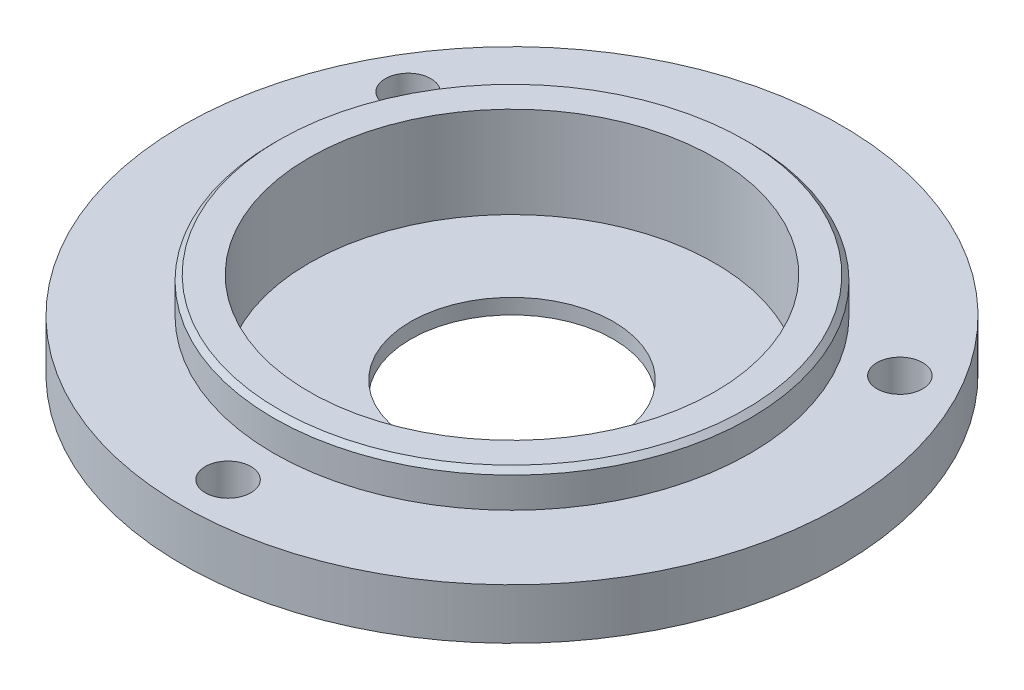
from build123d import *

# Parameters (mm, degrees)
ESQUISSE2_R                  = 2.25
ENL_V_MAT_EXTRU_1_DEPTH      = 47.491934784
R_P_TITION_CIRCULAIRE1_COUNT = 3


with BuildPart() as part:
    # Esquisse1 → Révolution1 (revolve)
    with BuildSketch(Plane.XY):
        Polygon((-10, -7), (-10, -5.5), (-20, -5.5), (-20, 3.5), (-23, 3.5), (-23.5, 3), (-23.5, 0), (-32.5, 0), (-32.5, -5), (-22, -5), (-22, -7), align=None)
    revolve(axis=Axis((0, 39.107095159, 0), (0, -1, 0)))

    # Esquisse2 → Enlèv. mat.-Extru.1 (cut, through all)
    with BuildSketch(Plane(origin=(0, 0, 0), x_dir=(-1, 0, 0), z_dir=(0, 1, 0))):
        with Locations((0, 28)):
            Circle(ESQUISSE2_R)
    enl_v_mat_extru_1 = extrude(amount=-ENL_V_MAT_EXTRU_1_DEPTH, mode=Mode.SUBTRACT)

    # Répétition circulaire1: Enlèv. mat.-Extru.1 ×3 about axis
    r_p_tition_circulaire1_axis = Axis((0, 0, 0), (0, 1, 0))
    for i in range(1, R_P_TITION_CIRCULAIRE1_COUNT):
        add(enl_v_mat_extru_1.rotate(r_p_tition_circulaire1_axis, i * 360 / R_P_TITION_CIRCULAIRE1_COUNT), mode=Mode.SUBTRACT)


solid = part.part
